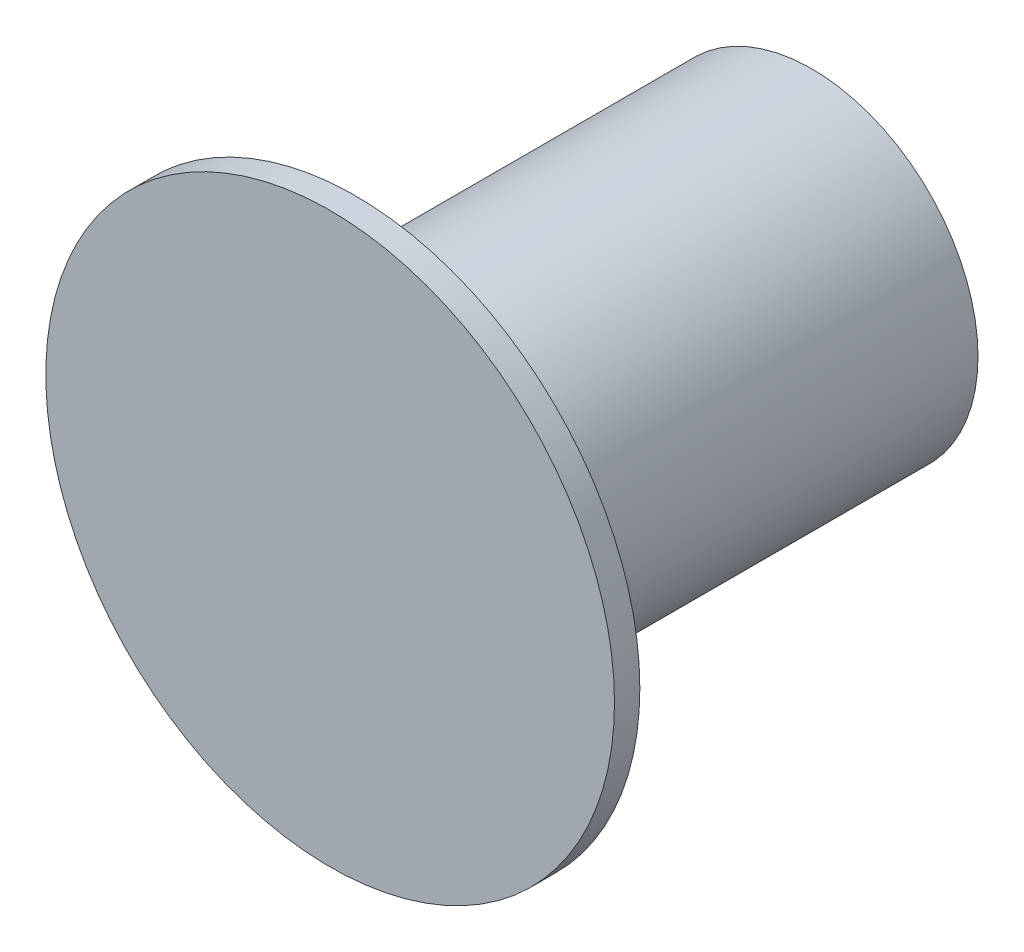
from build123d import *

# Parameters (mm, degrees)
SKETCH2_R           = 6.549662411
BOSS_EXTRUDE1_DEPTH = 18
SKETCH3_R           = 11.213774428
BOSS_EXTRUDE2_DEPTH = 1


with BuildPart() as part:
    # Sketch2 → Boss-Extrude1 (new body)
    with BuildSketch(Plane.XY.offset(-10)):
        with Locations((-12.382339739, -201.480712532)):
            Circle(SKETCH2_R)
    extrude(amount=-BOSS_EXTRUDE1_DEPTH)

    # Sketch3 → Boss-Extrude2 (add)
    with BuildSketch(Plane.XY.offset(-10)):
        with Locations((-12.382339739, -201.480712532)):
            Circle(SKETCH3_R)
    extrude(amount=BOSS_EXTRUDE2_DEPTH)


solid = part.part
